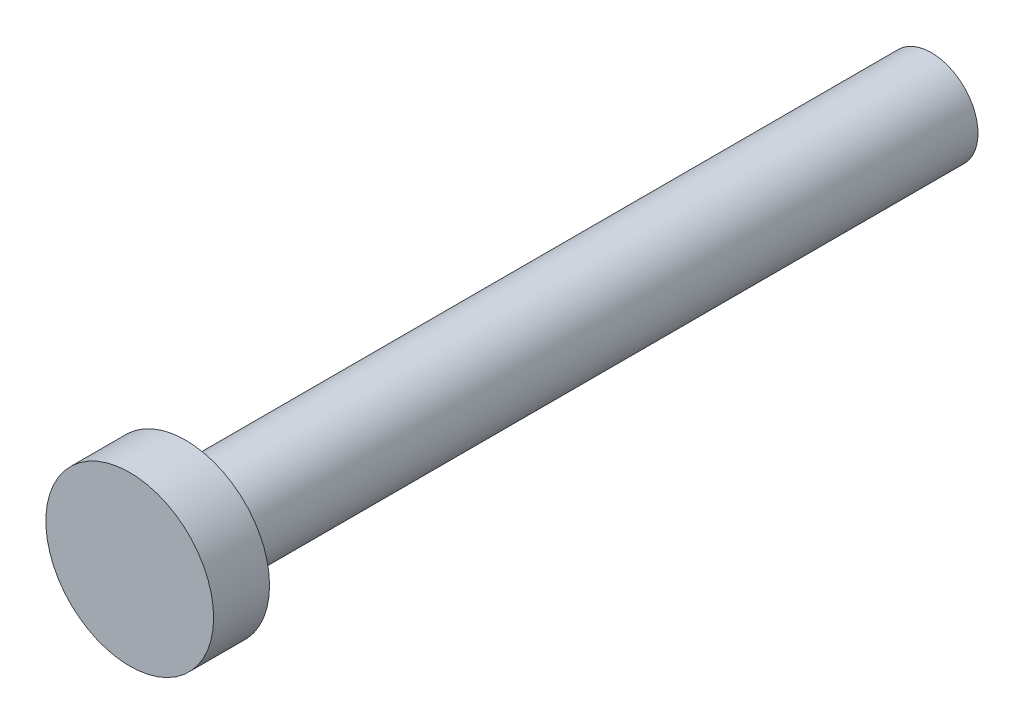
from build123d import *

# Parameters (mm, degrees)
SKETCH2_R                = 2.5
M5_REFERENCE_SHANK_DEPTH = 40
REFERENCE_HEAD_START     = 40
SKETCH3_R                = 4.5
REFERENCE_HEAD_DEPTH     = 3


with BuildPart() as part:
    # Sketch2 → M5_reference_shank (new body)
    with BuildSketch(Plane.XY):
        Circle(SKETCH2_R)
    extrude(amount=M5_REFERENCE_SHANK_DEPTH)

    # Sketch3 → Reference_head (add)
    with BuildSketch(Plane.XY.offset(REFERENCE_HEAD_START)):
        Circle(SKETCH3_R)
    extrude(amount=REFERENCE_HEAD_DEPTH)


solid = part.part
